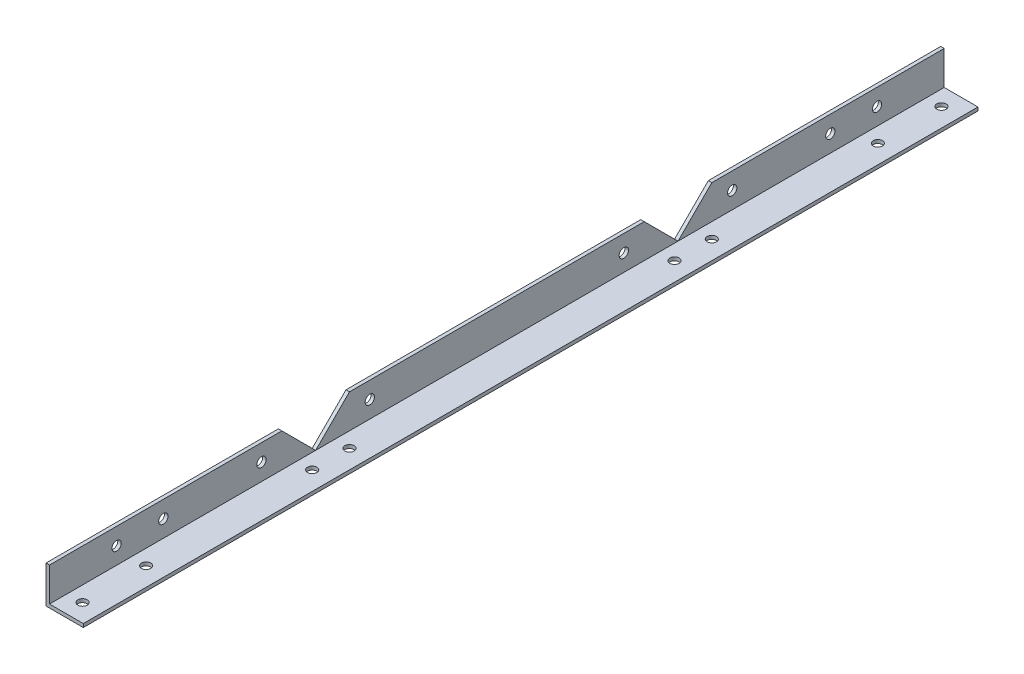
from build123d import *

# Parameters (mm, degrees)
BOSS_EXTRUDE1_DEPTH = 208.28
SKETCH2_R           = 2.38125
CUT_EXTRUDE1_DEPTH  = 1.778
SKETCH3_W           = 1.778
SKETCH3_H           = 17.272
BOSS_EXTRUDE2_DEPTH = 20.32
SKETCH4_R           = 2.38125
CUT_EXTRUDE2_DEPTH  = 1.778


with BuildPart() as part:
    # Sketch1 → Boss-Extrude1 (new body)
    with BuildSketch(Plane.XY):
        Polygon((0, 0), (0, 17.272), (-1.778, 17.272), (-1.778, -1.778), (17.272, -1.778), (17.272, 0), align=None)
    boss_extrude1 = extrude(amount=BOSS_EXTRUDE1_DEPTH)

    # Sketch2 → Cut-Extrude1 (cut)
    with BuildSketch(Plane(origin=(0, 0, 0), x_dir=(0, 0, -1), z_dir=(1, 0, 0))):
        with Locations(Location((-194.31, 8.636, 0), (0, 0, 90))):
            Circle(SKETCH2_R)
        with Locations(Location((-170.434, 8.636, 0), (0, 0, 90))):
            Circle(SKETCH2_R)
        with Locations(Location((-120.269, 8.636, 0), (0, 0, 90))):
            Circle(SKETCH2_R)
        with Locations(Location((-64.897, 8.636, 0), (0, 0, 90))):
            Circle(SKETCH2_R)
        Polygon((-92.583, 0), (-109.855, 17.272), (-75.311, 17.272), align=None)
    cut_extrude1 = extrude(amount=-CUT_EXTRUDE1_DEPTH, mode=Mode.SUBTRACT)

    # Sketch3 → Boss-Extrude2 (add)
    with BuildSketch(Plane.XY.offset(208.28)):
        Polygon((-1.778, 0), (-1.778, -1.778), (17.272, -1.778), (17.272, 0), (0, 0), align=None)
        with Locations((-0.889, 8.636)):
            Rectangle(SKETCH3_W, SKETCH3_H)
    boss_extrude2 = extrude(amount=BOSS_EXTRUDE2_DEPTH)

    # Sketch4 → Cut-Extrude2 (cut)
    with BuildSketch(Plane(origin=(0, 0, 0), x_dir=(1, 0, 0), z_dir=(0, 1, 0))):
        with Locations(Location((7.747, -219.456, 0), (0, 0, 180))):
            Circle(SKETCH4_R)
        with Locations(Location((7.747, -83.058, 0), (0, 0, 180))):
            Circle(SKETCH4_R)
        with Locations(Location((7.747, -102.108, 0), (0, 0, 180))):
            Circle(SKETCH4_R)
        with Locations(Location((7.747, -186.944, 0), (0, 0, 180))):
            Circle(SKETCH4_R)
    cut_extrude2 = extrude(amount=-CUT_EXTRUDE2_DEPTH, mode=Mode.SUBTRACT)

    # Mirror3: Boss-Extrude1, Cut-Extrude1, Boss-Extrude2, Cut-Extrude2 across plane
    add(boss_extrude1.mirror(Plane(origin=(0, 0, 0), x_dir=(1, 0, 0), z_dir=(0, 0, -1))))
    add(cut_extrude1.mirror(Plane(origin=(0, 0, 0), x_dir=(1, 0, 0), z_dir=(0, 0, -1))), mode=Mode.SUBTRACT)
    add(boss_extrude2.mirror(Plane(origin=(0, 0, 0), x_dir=(1, 0, 0), z_dir=(0, 0, -1))))
    add(cut_extrude2.mirror(Plane(origin=(0, 0, 0), x_dir=(1, 0, 0), z_dir=(0, 0, -1))), mode=Mode.SUBTRACT)


solid = part.part
